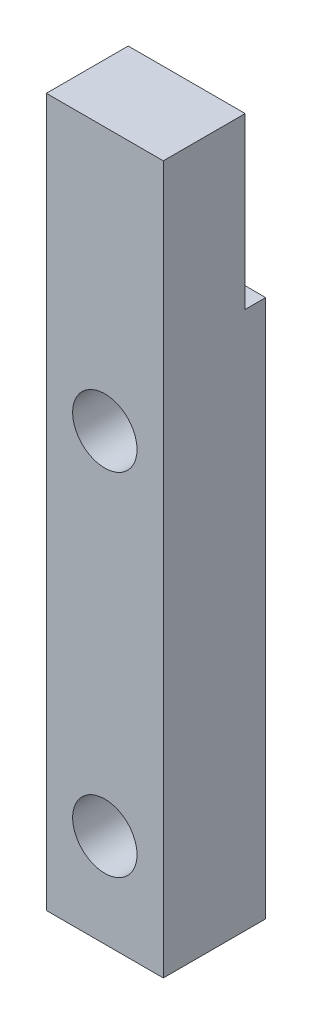
from build123d import *

# Parameters (mm, degrees)
SKETCH1_R           = 5.5
BOSS_EXTRUDE1_DEPTH = 3.5
SKETCH2_R           = 5.5
BOSS_EXTRUDE2_DEPTH = 14


with BuildPart() as part:
    # Sketch1 → Boss-Extrude1 (new body)
    with BuildSketch(Plane.XY.offset(300)):
        Polygon((75, 66), (95, 66), (95, -26), (85, -26), (75, -26), (75, 10), (75, 50), (75, 60), align=None)
        with Locations((85, -10)):
            Circle(SKETCH1_R, mode=Mode.SUBTRACT)
        with Locations((85, 50)):
            Circle(SKETCH1_R, mode=Mode.SUBTRACT)
    extrude(amount=BOSS_EXTRUDE1_DEPTH)

    # Sketch2 → Boss-Extrude2 (add)
    with BuildSketch(Plane.XY.offset(303.5)):
        Polygon((75, 10), (75, 85), (75, 95), (95, 95), (95, 66), (95, -26), (75, -26), align=None)
        with Locations((85, 50)):
            Circle(SKETCH2_R, mode=Mode.SUBTRACT)
        with Locations((85, -10)):
            Circle(SKETCH2_R, mode=Mode.SUBTRACT)
    extrude(amount=BOSS_EXTRUDE2_DEPTH)


solid = part.part
